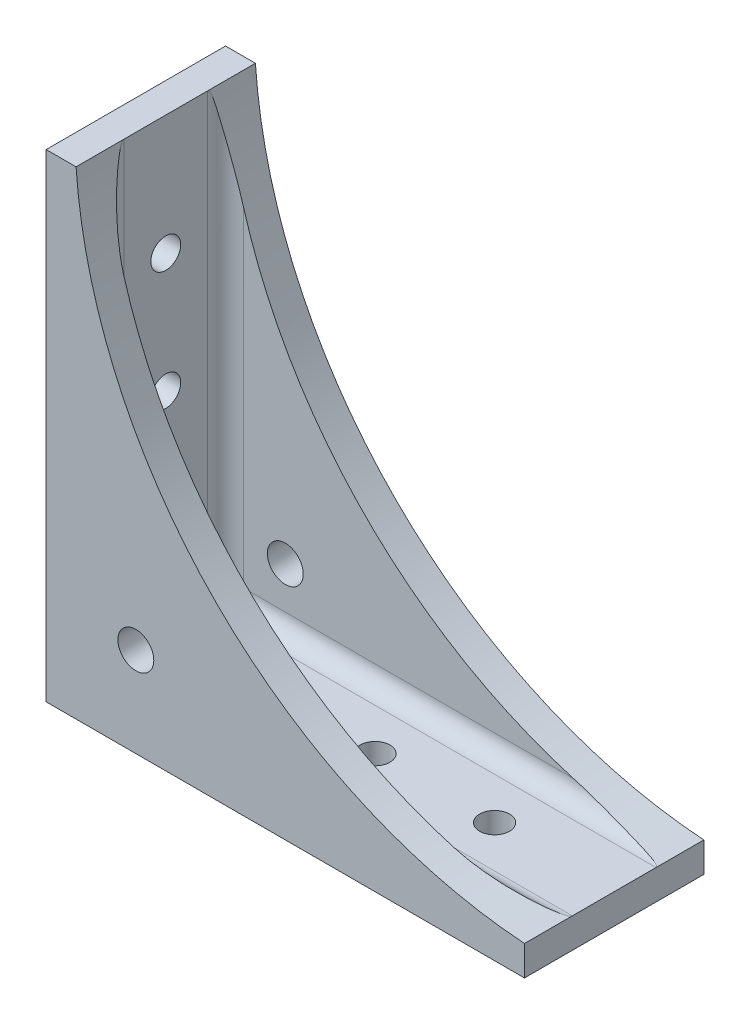
from build123d import *

# Parameters (mm, degrees)
BOSS_EXTRUDE2_DEPTH = 30
SKETCH5_R           = 2.5
CUT_EXTRUDE3_DEPTH  = 6
SKETCH6_R           = 2.5
CUT_EXTRUDE4_DEPTH  = 6
BOSS_EXTRUDE3_DEPTH = 5
BOSS_EXTRUDE4_DEPTH = 5
FILLET1_R           = 3
FILLET2_R           = 3
FILLET3_R           = 3
CUT_EXTRUDE5_DEPTH  = 118.046999107
SKETCH10_R          = 3
CUT_EXTRUDE6_DEPTH  = 118.04699927


with BuildPart() as part:
    # Sketch4 → Boss-Extrude2 (new body)
    with BuildSketch(Plane.XY):
        Polygon((0, 0), (0, 80), (5, 80), (5, 5), (80, 5), (80, 0), align=None)
    extrude(amount=BOSS_EXTRUDE2_DEPTH)

    # Sketch5 → Cut-Extrude3 (cut)
    with BuildSketch(Plane(origin=(0, 5, 0), x_dir=(1, 0, 0), z_dir=(0, 1, 0))):
        with Locations(Location((60, -15, 0), (0, 0, 270))):
            Circle(SKETCH5_R)
        with Locations(Location((40, -15, 0), (0, 0, 270))):
            Circle(SKETCH5_R)
    extrude(amount=-CUT_EXTRUDE3_DEPTH, mode=Mode.SUBTRACT)

    # Sketch6 → Cut-Extrude4 (cut)
    with BuildSketch(Plane(origin=(5, 0, 0), x_dir=(0, 0, -1), z_dir=(1, 0, 0))):
        with Locations(Location((-15, 60, 0), (0, 0, 90))):
            Circle(SKETCH6_R)
        with Locations(Location((-15, 40, 0), (0, 0, 90))):
            Circle(SKETCH6_R)
    extrude(amount=-CUT_EXTRUDE4_DEPTH, mode=Mode.SUBTRACT)

    # Sketch7 → Boss-Extrude3 (add)
    with BuildSketch(Plane(origin=(0, 0, 0), x_dir=(-1, 0, 0), z_dir=(0, 0, -1))):
        Polygon((-5, 80), (-5, 5), (-80, 5), align=None)
    extrude(amount=-BOSS_EXTRUDE3_DEPTH)

    # Sketch8 → Boss-Extrude4 (add)
    with BuildSketch(Plane.XY.offset(30)):
        Polygon((5, 80), (5, 5), (80, 5), align=None)
    extrude(amount=-BOSS_EXTRUDE4_DEPTH)

    # Fillet1
    fillet1_edges = [part.edges().sort_by_distance(p)[0] for p in [
        (5, 42.5, 25),
    ]]
    fillet(fillet1_edges, radius=FILLET1_R)

    # Fillet2
    fillet2_edges = [part.edges().sort_by_distance(p)[0] for p in [
        (5, 42.5, 5),
    ]]
    fillet(fillet2_edges, radius=FILLET2_R)

    # Fillet3
    fillet3_edges = [part.edges().sort_by_distance(p)[0] for p in [
        (44, 5, 5),
        (5, 5, 15),
        (44, 5, 25),
        (5.878679656, 5, 24.121320344),
        (5.878679656, 5, 5.878679656),
    ]]
    fillet(fillet3_edges, radius=FILLET3_R)

    # Sketch9 → Cut-Extrude5 (cut, through all)
    with BuildSketch(Plane.XY.offset(30)):
        with BuildLine():
            Line((5, 80), (80, 5))
            ThreePointArc((80, 5), (28.499618275, 28.499618275), (5, 80))
        make_face()
    extrude(amount=-CUT_EXTRUDE5_DEPTH, mode=Mode.SUBTRACT)

    # Sketch10 → Cut-Extrude6 (cut, through all)
    with BuildSketch(Plane.XY.offset(30)):
        with Locations((15, 15)):
            Circle(SKETCH10_R)
    extrude(amount=-CUT_EXTRUDE6_DEPTH, mode=Mode.SUBTRACT)


solid = part.part
